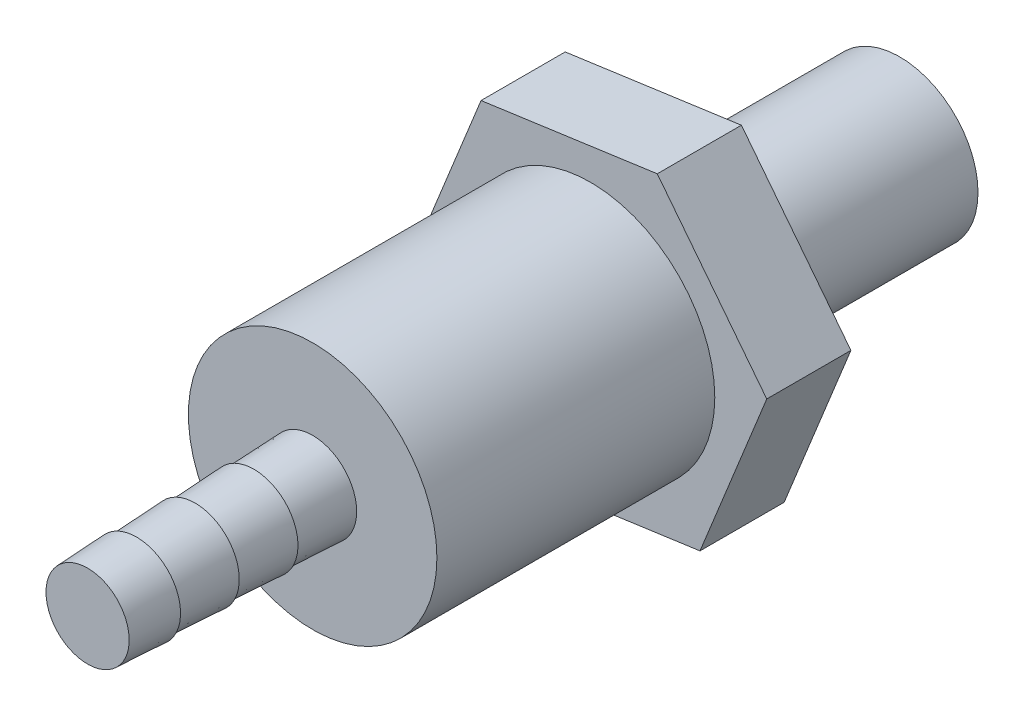
from build123d import *

# Parameters (mm, degrees)
ESQUISSE1_R      = 4
EXTRUSION1_DEPTH = 11.5
EXTRUSION2_DEPTH = 4.3
ESQUISSE3_R      = 6.35
EXTRUSION3_DEPTH = 14.2


with BuildPart() as part:
    # Esquisse1 → Extrusion1 (new body)
    with BuildSketch(Plane.XY):
        Circle(ESQUISSE1_R)
    extrude(amount=EXTRUSION1_DEPTH)

    # Esquisse2 → Extrusion2 (add)
    with BuildSketch(Plane.XY.offset(11.5)):
        Polygon((3.411005357, 8.429267018), (-5.594456694, 7.168650801), (-9.005462051, -1.260616217), (-3.411005357, -8.429267018), (5.594456694, -7.168650801), (9.005462051, 1.260616217), align=None)
    extrude(amount=EXTRUSION2_DEPTH)

    # Esquisse3 → Extrusion3 (add)
    with BuildSketch(Plane.XY.offset(15.8)):
        Circle(ESQUISSE3_R)
    extrude(amount=EXTRUSION3_DEPTH)

    # Esquisse4 → Révolution4 (revolve)
    with BuildSketch(Plane(origin=(0, 0, 0), x_dir=(1, 0, 0), z_dir=(0, 1, 0))):
        Polygon((0, -30), (0, -41.5), (-2.125, -41.5), (-2.25, -39), (-2.1, -39), (-2.25, -36), (-2.1, -36), (-2.25, -33), (-2.125, -33), (-2.25, -30), align=None)
    revolve(axis=Axis((0, 0, 18.076774383), (0, 0, 1)))


solid = part.part
